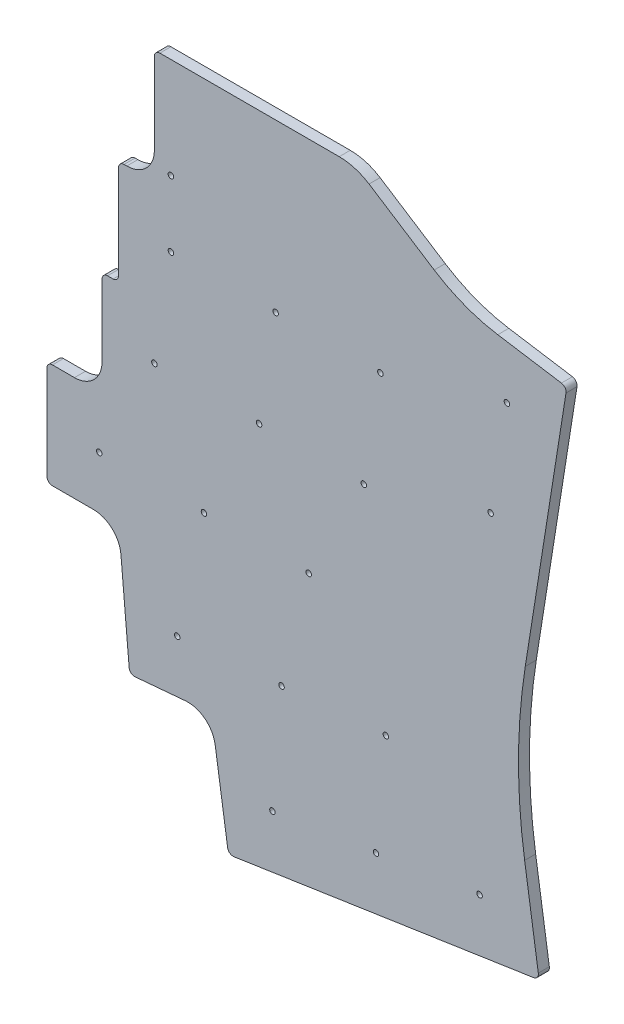
from build123d import *

# Parameters (mm, degrees)
SKETCH1_R           = 0.5
BOSS_EXTRUDE1_DEPTH = 2
FILLET1_R           = 30
FILLET5_R           = 100
FILLET2_R           = 10
FILLET3_R           = 1
FILLET4_R           = 5


with BuildPart() as part:
    # Sketch1 → Boss-Extrude1 (new body)
    with BuildSketch(Plane(origin=(0, 0, 0), x_dir=(0, 1, 0), z_dir=(0, 0, 1))):
        Polygon((-89.468095407, -10.44451917), (-68.806810142, -7.332792233), (-70.103747412, 7.491268603), (-47.5, 9.468840255), (-47.5, 22.5), (-28.5, 22.5), (-28.5, 12.5), (-9.5, 12.5), (-9.5, 9.5), (9.5, 9.5), (9.5, 3), (30.24, 3), (30.24, -33.48), (17.635245125, -53.075343018), (14.662990289, -71.841421489), (-48.241456697, -61.878335859), (-80.979250129, -66.808865222), align=None)
        with Locations(Location((-56.5, -39, 0), (0, 0, 270))):
            Circle(SKETCH1_R, mode=Mode.SUBTRACT)
        with Locations(Location((-73, -56, 0), (0, 0, 270))):
            Circle(SKETCH1_R, mode=Mode.SUBTRACT)
        with Locations(Location((0, 0, 0), (0, 0, 270))):
            Circle(SKETCH1_R, mode=Mode.SUBTRACT)
        with Locations(Location((-38, 13, 0), (0, 0, 270))):
            Circle(SKETCH1_R, mode=Mode.SUBTRACT)
        with Locations(Location((-19, 3, 0), (0, 0, 270))):
            Circle(SKETCH1_R, mode=Mode.SUBTRACT)
        with Locations(Location((12, 0, 0), (0, 0, 270))):
            Circle(SKETCH1_R, mode=Mode.SUBTRACT)
        with Locations(Location((-12, -58, 0), (0, 0, 270))):
            Circle(SKETCH1_R, mode=Mode.SUBTRACT)
        with Locations(Location((0, -19, 0), (0, 0, 270))):
            Circle(SKETCH1_R, mode=Mode.SUBTRACT)
        with Locations(Location((-19, -16, 0), (0, 0, 270))):
            Circle(SKETCH1_R, mode=Mode.SUBTRACT)
        with Locations(Location((-38, -6, 0), (0, 0, 270))):
            Circle(SKETCH1_R, mode=Mode.SUBTRACT)
        with Locations(Location((0, -38, 0), (0, 0, 270))):
            Circle(SKETCH1_R, mode=Mode.SUBTRACT)
        with Locations(Location((-19, -35, 0), (0, 0, 270))):
            Circle(SKETCH1_R, mode=Mode.SUBTRACT)
        with Locations(Location((-38, -25, 0), (0, 0, 270))):
            Circle(SKETCH1_R, mode=Mode.SUBTRACT)
        with Locations(Location((-58.155959112, -20.072300736, 0), (0, 0, 270))):
            Circle(SKETCH1_R, mode=Mode.SUBTRACT)
        with Locations(Location((-59.811918224, -1.144601473, 0), (0, 0, 270))):
            Circle(SKETCH1_R, mode=Mode.SUBTRACT)
        with Locations(Location((-75.829615093, -37.211884649, 0), (0, 0, 270))):
            Circle(SKETCH1_R, mode=Mode.SUBTRACT)
        with Locations(Location((-78.659230186, -18.423769299, 0), (0, 0, 270))):
            Circle(SKETCH1_R, mode=Mode.SUBTRACT)
        with Locations(Location((6.766078471, -60.972254836, 0), (0, 0, 270))):
            Circle(SKETCH1_R, mode=Mode.SUBTRACT)
    extrude(amount=BOSS_EXTRUDE1_DEPTH)

    # Fillet1
    fillet1_edges = [part.edges().sort_by_distance(p)[0] for p in [
        (53.075343018, 17.635245125, 1),
    ]]
    fillet(fillet1_edges, radius=FILLET1_R)

    # Fillet5
    fillet5_edges = [part.edges().sort_by_distance(p)[0] for p in [
        (61.878335859, -48.241456697, 1),
    ]]
    fillet(fillet5_edges, radius=FILLET5_R)

    # Fillet2
    fillet2_edges = [part.edges().sort_by_distance(p)[0] for p in [
        (33.48, 30.24, 1),
    ]]
    fillet(fillet2_edges, radius=FILLET2_R)

    # Fillet3
    fillet3_edges = [part.edges().sort_by_distance(p)[0] for p in [
        (10.44451917, -89.468095407, 1),
        (-7.491268603, -70.103747412, 1),
        (-22.5, -47.5, 1),
        (-22.5, -28.5, 1),
        (-12.5, -9.5, 1),
        (-9.5, -9.5, 1),
        (-9.5, 9.5, 1),
        (-3, 30.24, 1),
        (71.841421489, 14.662990289, 1),
        (66.808865222, -80.979250129, 1),
    ]]
    fillet(fillet3_edges, radius=FILLET3_R)

    # Fillet4
    fillet4_edges = [part.edges().sort_by_distance(p)[0] for p in [
        (7.332792233, -68.806810142, 1),
        (-9.468840255, -47.5, 1),
        (-12.5, -28.5, 1),
        (-3, 9.5, 1),
    ]]
    fillet(fillet4_edges, radius=FILLET4_R)


solid = part.part
